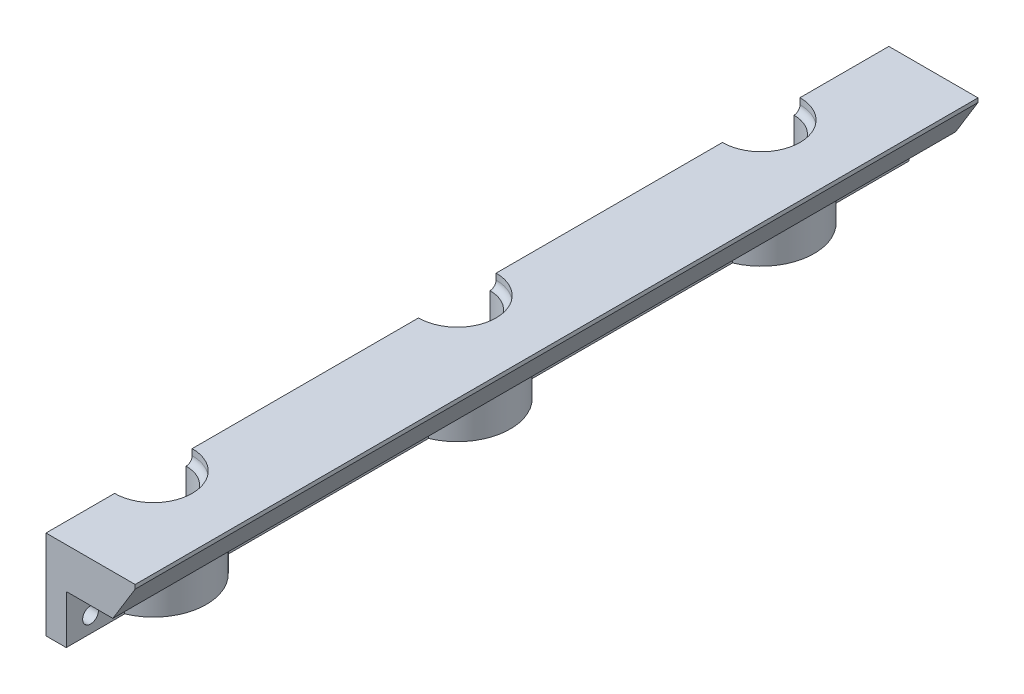
from build123d import *
from OCP.BRepFilletAPI import BRepFilletAPI_MakeChamfer

# Parameters (mm, degrees)
BOSS_EXTRUDE1_DEPTH        = 10
BOSS_EXTRUDE2_DEPTH        = 12
CUT_EXTRUDE3_DEPTH         = 6
CUT_EXTRUDE3_DEPTH_BACK    = 14
SKETCH7_R                  = 1.95
SKETCH8_R                  = 1.95
CUT_EXTRUDE4_DEPTH         = 4
SKETCH9_R                  = 1.5
CUT_EXTRUDE5_DEPTH         = 4
LPATTERN1_COUNT            = 2
LPATTERN1_PITCH            = 75
CHAMFER2_SIZE              = 5.5
CHAMFER2_SIZE2             = 9
CHAMFER3_SIZE              = 7
CHAMFER3_SIZE2             = 2
LPATTERN2_COUNT            = 3
LPATTERN2_PITCH            = 75
SZKIC1_W                   = 22.668374216
SZKIC1_H                   = 5
WYTNIJ_WYCI_GNI_CIE1_DEPTH = 30.5


with BuildPart() as part:
    # Sketch1 → Boss-Extrude1 (new body)
    with BuildSketch(Plane(origin=(0, 0, 0), x_dir=(1, 0, 0), z_dir=(0, 1, 0))):
        with BuildLine():
            Line((0, -8.075), (0, -31.5))
            Line((0, -31.5), (22, -31.5))
            Line((22, -31.5), (22, 181.5))
            Line((22, 181.5), (0, 181.5))
            Line((0, 181.5), (0, 158.075))
            ThreePointArc((0, 158.075), (8.075, 150), (0, 141.925))
            Line((0, 141.925), (0, 83.075))
            ThreePointArc((0, 83.075), (8.075, 75), (0, 66.925))
            Line((0, 66.925), (0, 8.075))
            ThreePointArc((0, 8.075), (8.075, 0), (0, -8.075))
        make_face()
    extrude(amount=-BOSS_EXTRUDE1_DEPTH)

    # Sketch3 → Boss-Extrude2 (add)
    with BuildSketch(Plane.XZ.offset(10)):
        with BuildLine():
            Line((0, -181.5), (0, -158.075))
            ThreePointArc((0, -158.075), (8.075, -150), (0, -141.925))
            Line((0, -141.925), (0, -83.075))
            ThreePointArc((0, -83.075), (8.075, -75), (0, -66.925))
            Line((0, -66.925), (0, -8.075))
            ThreePointArc((0, -8.075), (8.075, 0), (0, 8.075))
            Line((0, 8.075), (0, 31.5))
            Line((0, 31.5), (5, 31.5))
            Line((5, 31.5), (5, 12.081209583))
            ThreePointArc((5, 12.081209583), (13.075, 0), (5, -12.081209583))
            Line((5, -12.081209583), (5, -62.918790417))
            ThreePointArc((5, -62.918790417), (13.075, -75), (5, -87.081209583))
            Line((5, -87.081209583), (5, -137.918790417))
            ThreePointArc((5, -137.918790417), (13.075, -150), (5, -162.081209583))
            Line((5, -162.081209583), (5, -181.5))
            Line((5, -181.5), (0, -181.5))
        make_face()
    extrude(amount=BOSS_EXTRUDE2_DEPTH)

    # Sketch7 → Cut-Extrude3 (cut, two sides: drawn at the far end of the back side and taken through both)
    with BuildSketch(Plane.ZY.offset(-CUT_EXTRUDE3_DEPTH_BACK)):
        with Locations((-170.5, -4)):
            Circle(SKETCH7_R)
        with Locations((-170.5, -18)):
            Circle(SKETCH7_R)
        with Locations(Location((-129.5, -4, 0), (0, 0, 180))):
            Circle(SKETCH7_R)
        with Locations((-129.5, -18)):
            Circle(SKETCH7_R)
        with Locations((-95.5, -4)):
            Circle(SKETCH7_R)
        with Locations(Location((-54.5, -4, 0), (0, 0, 180))):
            Circle(SKETCH7_R)
        with Locations((-54.5, -18)):
            Circle(SKETCH7_R)
        with Locations((-95.5, -18)):
            Circle(SKETCH7_R)
        with Locations((-20.5, -4)):
            Circle(SKETCH7_R)
        with Locations(Location((20.5, -4, 0), (0, 0, 180))):
            Circle(SKETCH7_R)
        with Locations((20.5, -18)):
            Circle(SKETCH7_R)
        with Locations((-20.5, -18)):
            Circle(SKETCH7_R)
    extrude(amount=CUT_EXTRUDE3_DEPTH + CUT_EXTRUDE3_DEPTH_BACK, mode=Mode.SUBTRACT)

    # Sketch8 → Cut-Extrude4 (cut)
    with BuildSketch(Plane.ZY):
        with Locations((-112.5, -18.5)):
            Circle(SKETCH8_R)
    cut_extrude4 = extrude(amount=-CUT_EXTRUDE4_DEPTH, mode=Mode.SUBTRACT)

    # Sketch9 → Cut-Extrude5 (cut)
    with BuildSketch(Plane.ZY.offset(-4)):
        with Locations((-112.5, -18.5)):
            Circle(SKETCH9_R)
    cut_extrude5 = extrude(amount=-CUT_EXTRUDE5_DEPTH, mode=Mode.SUBTRACT)

    # LPattern1: Cut-Extrude4, Cut-Extrude5 ×2
    with Locations(*[(0, 0, i * LPATTERN1_PITCH) for i in range(1, LPATTERN1_COUNT)]):
        add(cut_extrude4, mode=Mode.SUBTRACT)
        add(cut_extrude5, mode=Mode.SUBTRACT)

    # Chamfer2
    chamfer2_edges = [part.edges().sort_by_distance(p)[0] for p in [
        (22, -10, -75),
    ]]
    chamfer2_side = [part.faces().sort_by_distance(p)[0] for p in [
        (14.183508734, -10, -75),
    ]]
    chamfer(chamfer2_edges, length=CHAMFER2_SIZE, length2=CHAMFER2_SIZE2, reference=chamfer2_side[0])

    # Chamfer3: one chamfer whose edges measure the first distance from different faces: ONE call of the kernel's chamfer builder (chamfer() names one face for all edges)
    chamfer3_edges_1 = [part.edges().sort_by_distance(p)[0] for p in [
        (8.075, -22, 0),
    ]]
    chamfer3_side_1 = [part.faces().sort_by_distance(p)[0] for p in [
        (8.075, -11, 0),
    ]]
    chamfer3_edges_2 = [part.edges().sort_by_distance(p)[0] for p in [
        (8.075, -22, -75),
    ]]
    chamfer3_side_2 = [part.faces().sort_by_distance(p)[0] for p in [
        (8.075, -11, -75),
    ]]
    chamfer3_edges_3 = [part.edges().sort_by_distance(p)[0] for p in [
        (8.075, -22, -150),
    ]]
    chamfer3_side_3 = [part.faces().sort_by_distance(p)[0] for p in [
        (8.075, -11, -150),
    ]]
    chamfer3 = BRepFilletAPI_MakeChamfer(part.part.solid().wrapped)
    for e in chamfer3_edges_1:
        chamfer3.Add(CHAMFER3_SIZE, CHAMFER3_SIZE2, e.wrapped, chamfer3_side_1[0].wrapped)  # the first distance lies on this face
    for e in chamfer3_edges_2:
        chamfer3.Add(CHAMFER3_SIZE, CHAMFER3_SIZE2, e.wrapped, chamfer3_side_2[0].wrapped)  # the first distance lies on this face
    for e in chamfer3_edges_3:
        chamfer3.Add(CHAMFER3_SIZE, CHAMFER3_SIZE2, e.wrapped, chamfer3_side_3[0].wrapped)  # the first distance lies on this face
    add(Compound.cast(chamfer3.Shape()), mode=Mode.REPLACE)

    # Sketch10 → Cut-Revolve1 (revolve, cut)
    with BuildSketch(Plane.ZY):
        with BuildLine():
            Line((-159.575, 1.581763394), (-159.575, -1.5))
            ThreePointArc((-159.575, -1.5), (-157.014339828, -2.560660172), (-158.075, 0))
            Line((-158.075, 0), (-159.575, 1.581763394))
        make_face()
    cut_revolve1 = revolve(axis=Axis((0, 2.197765982, -150), (0, -1, 0)), mode=Mode.SUBTRACT)

    # LPattern2: Cut-Revolve1 ×3
    with Locations(*[(0, 0, i * LPATTERN2_PITCH) for i in range(1, LPATTERN2_COUNT)]):
        add(cut_revolve1, mode=Mode.SUBTRACT)

    # Szkic1 → Wytnij-wyciągnięcie1 (cut)
    with BuildSketch(Plane(origin=(0, 0, 0), x_dir=(1, 0, 0), z_dir=(0, 1, 0))):
        with Locations((11.334187108, -29)):
            Rectangle(SZKIC1_W, SZKIC1_H)
    extrude(amount=-WYTNIJ_WYCI_GNI_CIE1_DEPTH, mode=Mode.SUBTRACT)


solid = part.part
